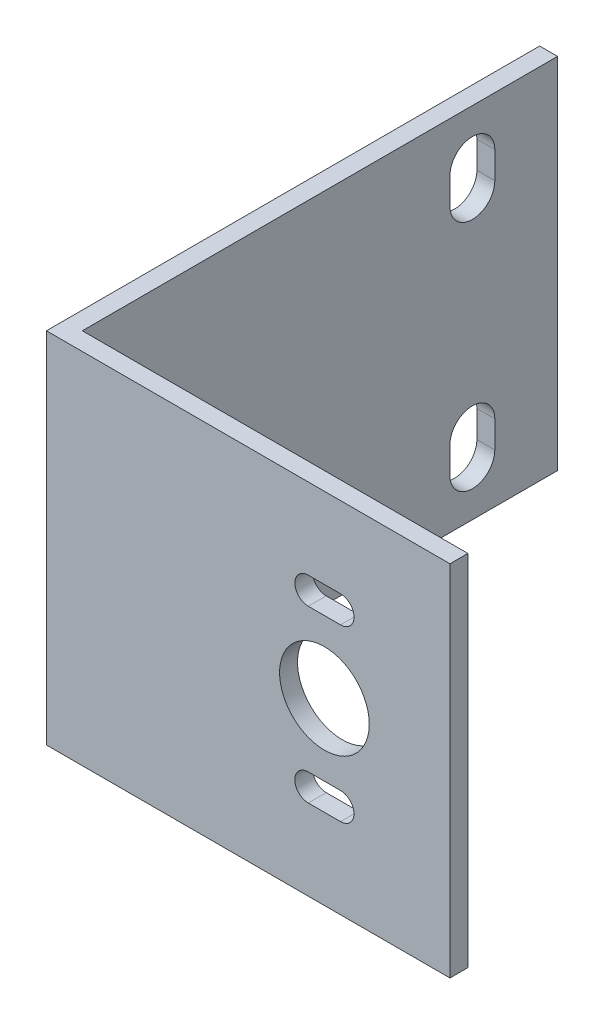
from build123d import *

# Parameters (mm, degrees)
ESQUISSE2_W             = 45
ESQUISSE2_H             = 40
ESQUISSE2_R             = 5
BOSS_EXTRU_8_DEPTH      = 2
ESQUISSE3_W             = 2
ESQUISSE3_H             = 53
BOSS_EXTRU_9_DEPTH      = 40
ENL_V_MAT_EXTRU_1_DEPTH = 40


with BuildPart() as part:
    # Esquisse2 → Boss.-Extru.8 (new body)
    with BuildSketch(Plane.XY):
        with Locations((29.457965055, 2.680327869)):
            Rectangle(ESQUISSE2_W, ESQUISSE2_H)
        with Locations((37.957965055, 2.680327869)):
            Circle(ESQUISSE2_R, mode=Mode.SUBTRACT)
        with BuildLine():
            Line((36.157965055, 13.680327869), (39.757965055, 13.680327869))
            ThreePointArc((39.757965055, 13.680327869), (41.257965055, 12.180327869), (39.757965055, 10.680327869))
            Line((39.757965055, 10.680327869), (36.157965055, 10.680327869))
            ThreePointArc((36.157965055, 10.680327869), (34.657965055, 12.180327869), (36.157965055, 13.680327869))
        make_face(mode=Mode.SUBTRACT)
        with BuildLine():
            Line((36.157965055, -8.319672131), (39.757965055, -8.319672131))
            ThreePointArc((39.757965055, -8.319672131), (41.257965055, -6.819672131), (39.757965055, -5.319672131))
            Line((39.757965055, -5.319672131), (36.157965055, -5.319672131))
            ThreePointArc((36.157965055, -5.319672131), (34.657965055, -6.819672131), (36.157965055, -8.319672131))
        make_face(mode=Mode.SUBTRACT)
    extrude(amount=BOSS_EXTRU_8_DEPTH)

    # Esquisse3 → Boss.-Extru.9 (add)
    with BuildSketch(Plane(origin=(0, 22.680327869, 0), x_dir=(1, 0, 0), z_dir=(0, 1, 0))):
        with Locations((7.957965055, 26.5)):
            Rectangle(ESQUISSE3_W, ESQUISSE3_H)
    extrude(amount=-BOSS_EXTRU_9_DEPTH)

    # Esquisse4 → Enlèv. mat.-Extru.1 (cut)
    with BuildSketch(Plane(origin=(8.957965055, 0, 0), x_dir=(0, 0, -1), z_dir=(1, 0, 0))):
        with BuildLine():
            Line((41, -11.819672131), (41, -8.819672131))
            ThreePointArc((41, -8.819672131), (43.5, -6.319672131), (46, -8.819672131))
            Line((46, -8.819672131), (46, -11.819672131))
            ThreePointArc((46, -11.819672131), (43.5, -14.319672131), (41, -11.819672131))
        make_face()
        with BuildLine():
            Line((41, 17.180327869), (41, 14.180327869))
            ThreePointArc((41, 14.180327869), (43.5, 11.680327869), (46, 14.180327869))
            Line((46, 14.180327869), (46, 17.180327869))
            ThreePointArc((46, 17.180327869), (43.5, 19.680327869), (41, 17.180327869))
        make_face()
    extrude(amount=-ENL_V_MAT_EXTRU_1_DEPTH, mode=Mode.SUBTRACT)


solid = part.part
